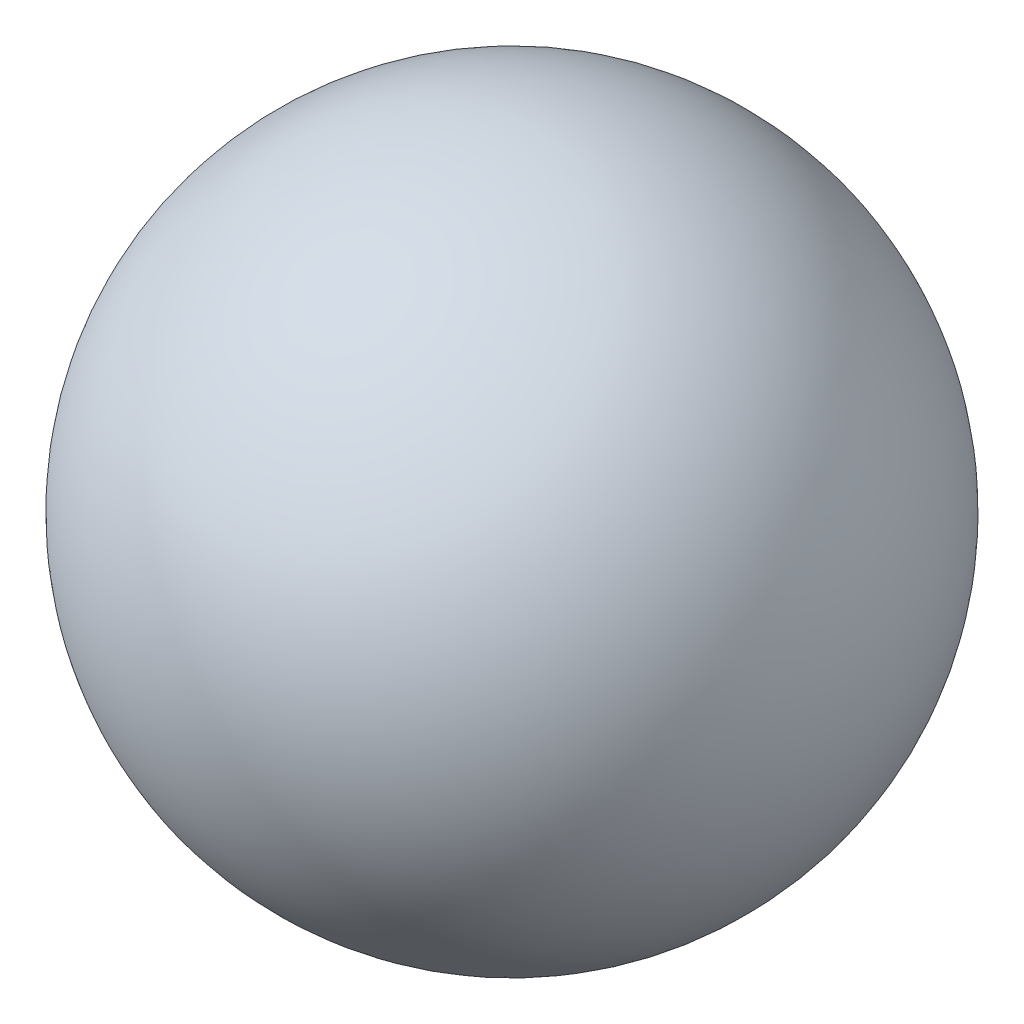
from build123d import *


with BuildPart() as part:
    # Sketch1 → Revolve2 (revolve)
    with BuildSketch(Plane(origin=(0, 0, 0), x_dir=(1, 0, 0), z_dir=(0, 1, 0))):
        with BuildLine():
            Line((0, 10.16), (0, -10.16))
            ThreePointArc((0, -10.16), (10.16, 0), (0, 10.16))
        make_face()
    revolve(axis=Axis((0, 0, -10.16), (0, 0, 1)))


solid = part.part
